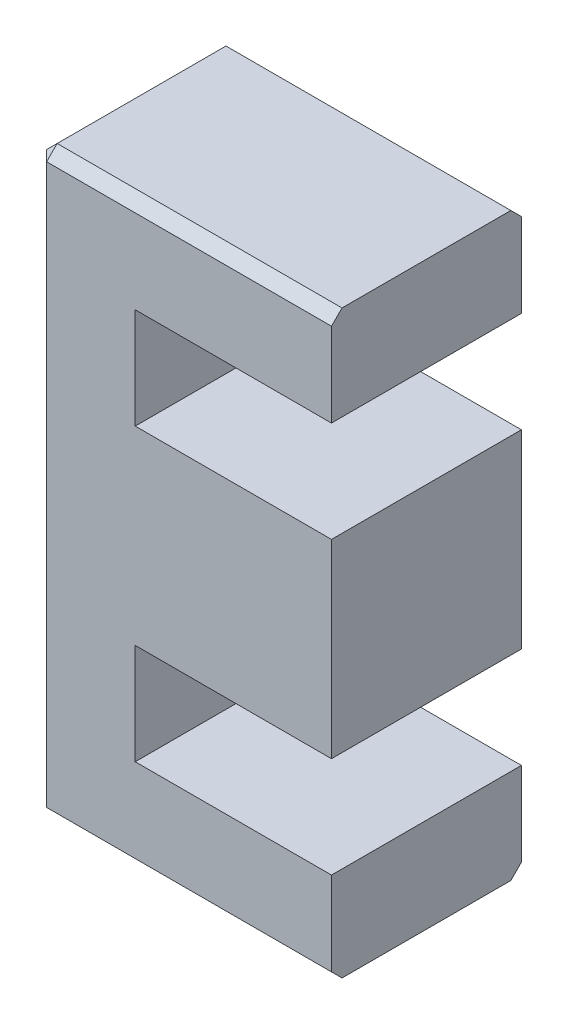
from build123d import *

# Parameters (mm, degrees)
BOSS_EXTRUDE1_DEPTH = 18
CHAMFER1_SIZE       = 2


with BuildPart() as part:
    # Sketch1 → Boss-Extrude1 (new, symmetric)
    with BuildSketch(Plane.XY):
        Polygon((28, 55), (-28, 55), (-28, -55), (28, -55), (28, -37.1), (-9.2, -37.1), (-9.2, -18), (28, -18), (28, 18), (-9.2, 18), (-9.2, 37.1), (28, 37.1), align=None)
    extrude(amount=BOSS_EXTRUDE1_DEPTH, both=True)

    # Chamfer1
    chamfer1_edges = [part.edges().sort_by_distance(p)[0] for p in [
        (-28, 0, 18),
        (0, -55, -18),
        (-28, 0, -18),
        (0, 55, -18),
        (0, -55, 18),
        (-28, -55, 0),
        (-28, 55, 0),
        (0, 55, 18),
    ]]
    chamfer(chamfer1_edges, length=CHAMFER1_SIZE)


solid = part.part
